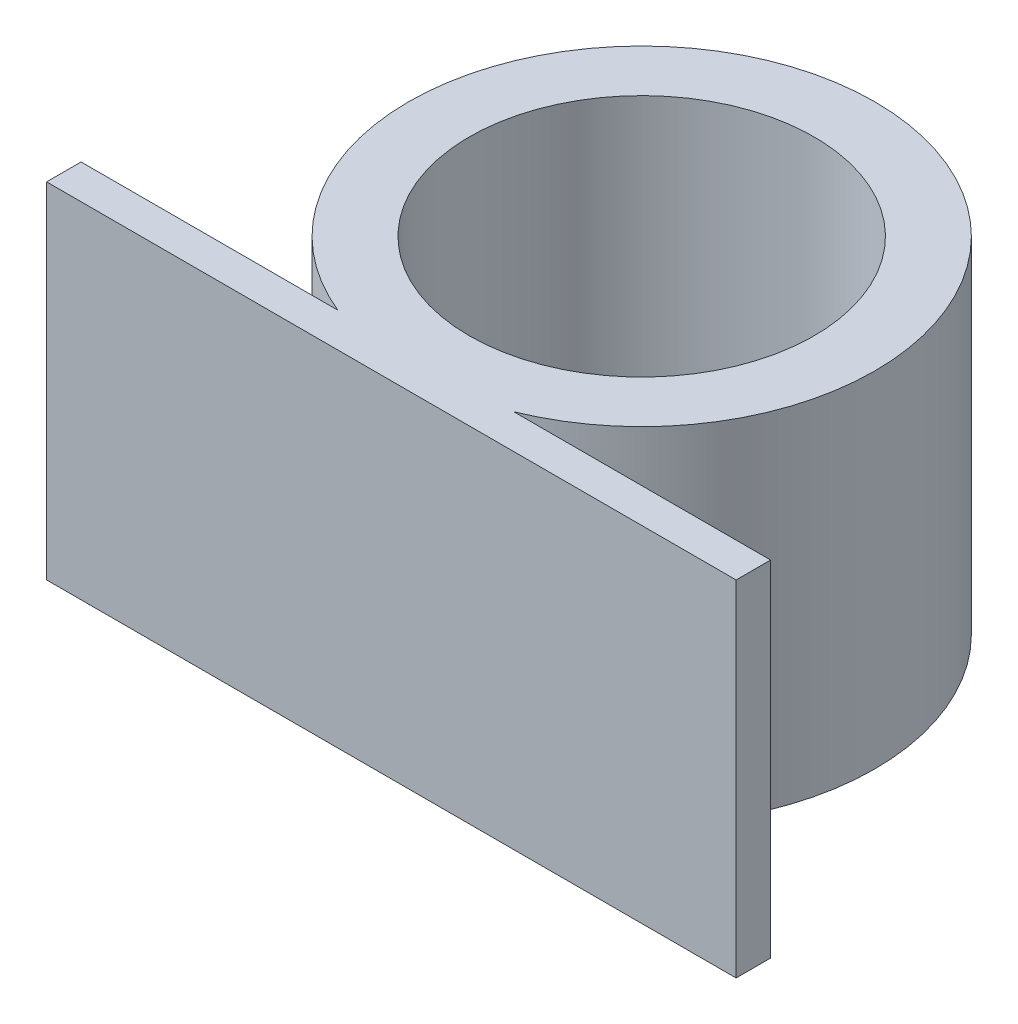
from build123d import *

# Parameters (mm, degrees)
SKETCH1_R           = 10
BOSS_EXTRUDE1_DEPTH = 20


with BuildPart() as part:
    # Sketch1 → Boss-Extrude1 (new body)
    with BuildSketch(Plane(origin=(0, 0, 0), x_dir=(1, 0, 0), z_dir=(0, 1, 0))):
        with BuildLine():
            Line((5.103736684, -12.52406407), (20, -12.52406407))
            Line((20, -12.52406407), (20, -14.52406407))
            Line((20, -14.52406407), (-20, -14.52406407))
            Line((-20, -14.52406407), (-20, -12.52406407))
            Line((-20, -12.52406407), (-5.103736684, -12.52406407))
            ThreePointArc((-5.103736684, -12.52406407), (0, 13.52406407), (5.103736684, -12.52406407))
        make_face()
        with Locations(Location((0, 0, 0), (0, 0, 270))):
            Circle(SKETCH1_R, mode=Mode.SUBTRACT)
    extrude(amount=BOSS_EXTRUDE1_DEPTH)


solid = part.part
